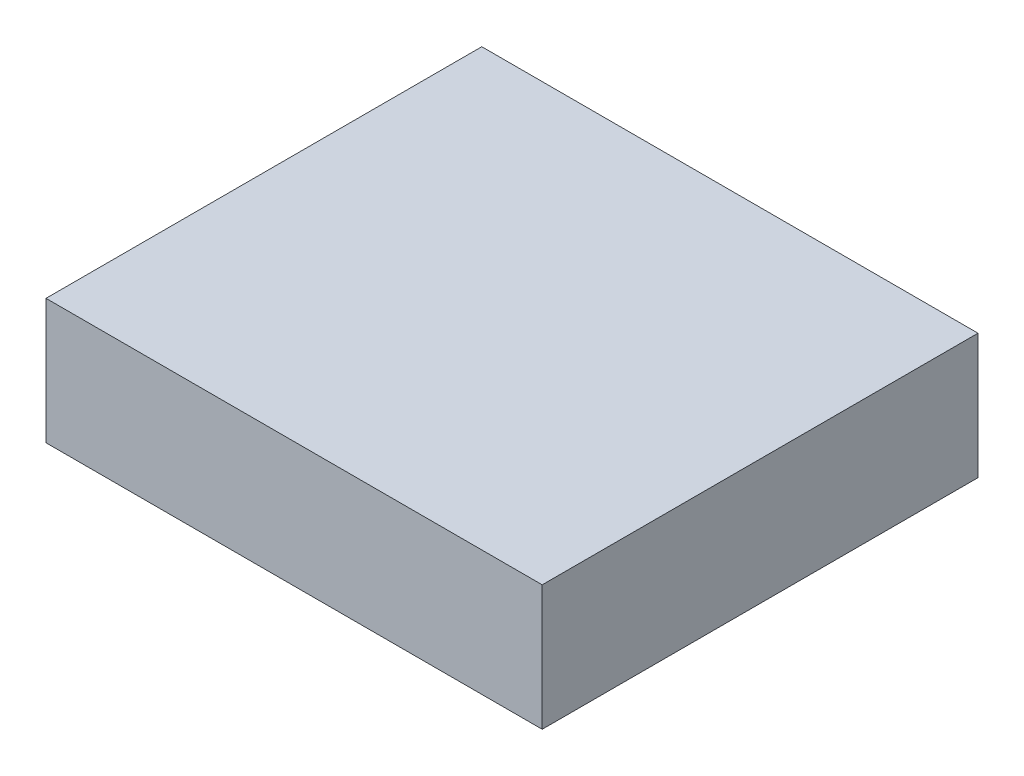
from build123d import *

# Parameters (mm, degrees)
SKETCH1_W           = 115
SKETCH1_H           = 101
BOSS_EXTRUDE1_DEPTH = 29


with BuildPart() as part:
    # Sketch1 → Boss-Extrude1 (new body)
    with BuildSketch(Plane(origin=(0, 0, 0), x_dir=(1, 0, 0), z_dir=(0, 1, 0))):
        Rectangle(SKETCH1_W, SKETCH1_H)
    extrude(amount=BOSS_EXTRUDE1_DEPTH)


solid = part.part
